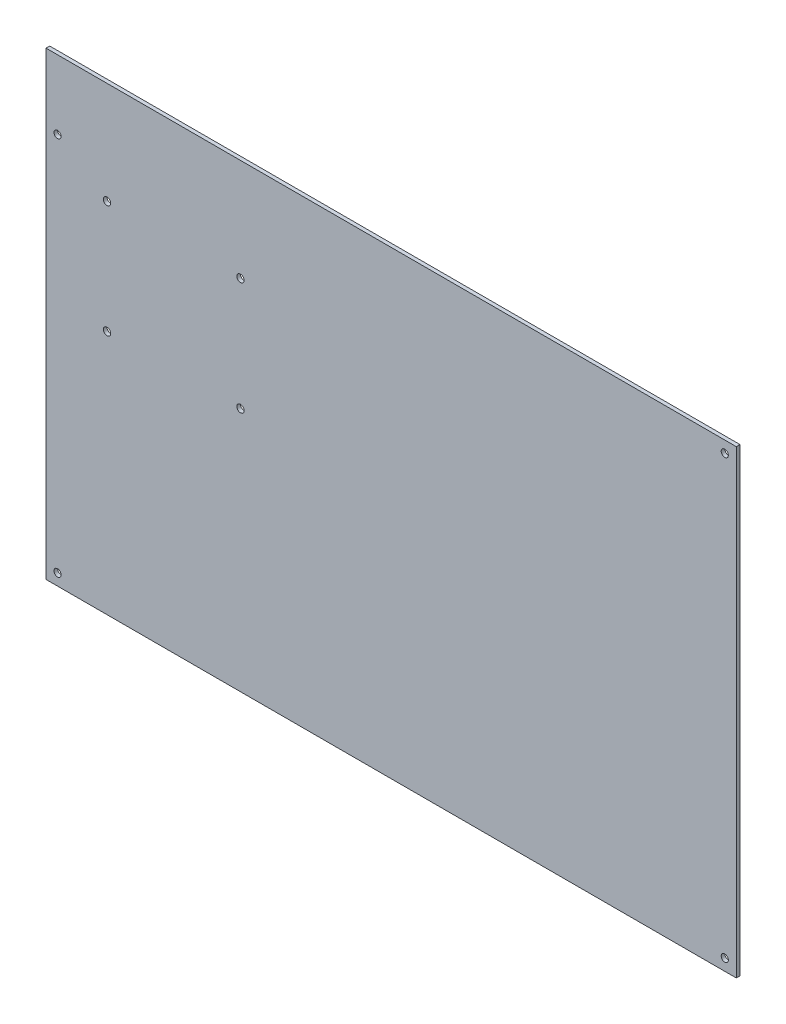
from build123d import *

# Parameters (mm, degrees)
SKETCH_1_W          = 300
SKETCH_1_H          = 200
SKETCH_1_R          = 1.55
EXTRUDE_1_DEPTH     = 1.6
SKETCH_2_R          = 1.6
CUT_EXTRUDE_1_DEPTH = 181.284663796


with BuildPart() as part:
    # ｽｹｯﾁ1 → ﾎﾞｽ - 押し出し1 (new body)
    with BuildSketch(Plane.XY):
        Rectangle(SKETCH_1_W, SKETCH_1_H)
        with Locations((-145, -95)):
            Circle(SKETCH_1_R, mode=Mode.SUBTRACT)
        with Locations((145, 95)):
            Circle(SKETCH_1_R, mode=Mode.SUBTRACT)
        with Locations((145, -95)):
            Circle(SKETCH_1_R, mode=Mode.SUBTRACT)
        with Locations((-145, 70)):
            Circle(SKETCH_1_R, mode=Mode.SUBTRACT)
    extrude(amount=EXTRUDE_1_DEPTH)

    # ｽｹｯﾁ2 → ｶｯﾄ - 押し出し1 (cut, through all)
    with BuildSketch(Plane.XY.offset(1.6)):
        with Locations((-123.5, 55.6)):
            Circle(SKETCH_2_R)
        with Locations((-65.5, 55.6)):
            Circle(SKETCH_2_R)
        with Locations((-123.5, 6.6)):
            Circle(SKETCH_2_R)
        with Locations((-65.5, 6.6)):
            Circle(SKETCH_2_R)
    extrude(amount=-CUT_EXTRUDE_1_DEPTH, mode=Mode.SUBTRACT)


solid = part.part
